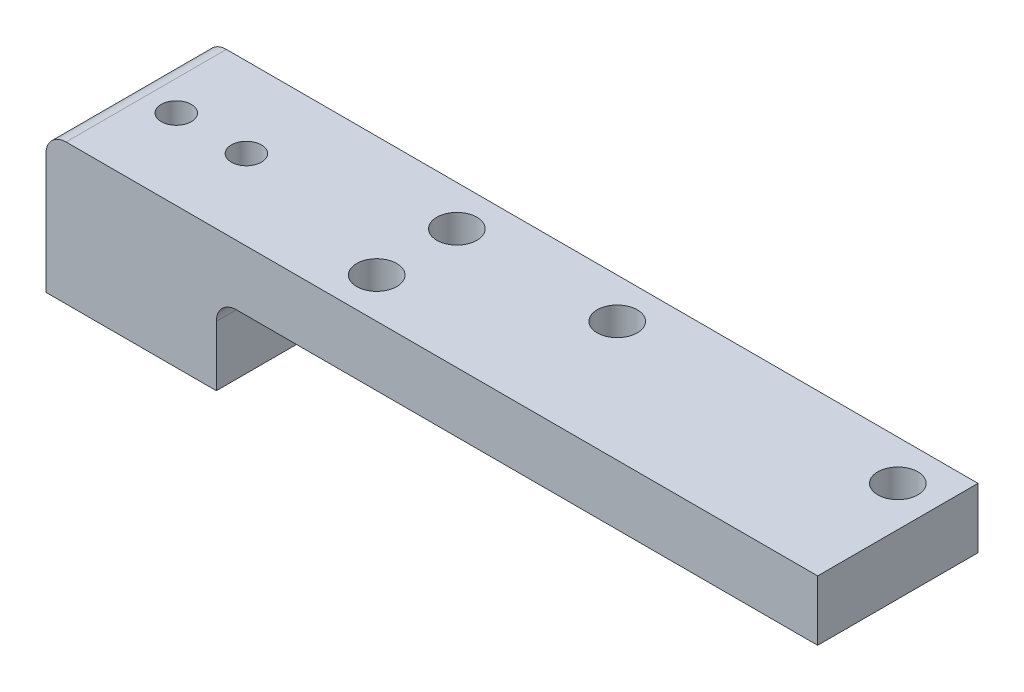
from build123d import *

# Parameters (mm, degrees)
SKETCH1_W           = 17
SKETCH1_H           = 16
SKETCH1_R           = 1.5
BOSS_EXTRUDE1_DEPTH = 14
SKETCH3_W           = 16
SKETCH3_H           = 6
BOSS_EXTRUDE2_DEPTH = 60
SKETCH4_R           = 2
CUT_EXTRUDE1_DEPTH  = 71.372224634
FILLET1_R           = 2
FILLET2_R           = 2


with BuildPart() as part:
    # Sketch1 → Boss-Extrude1 (new body)
    with BuildSketch(Plane(origin=(0, 0, 0), x_dir=(1, 0, 0), z_dir=(0, 1, 0))):
        Rectangle(SKETCH1_W, SKETCH1_H)
        with Locations(Location((-3.5, 0, 0), (0, 0, 270))):
            Circle(SKETCH1_R, mode=Mode.SUBTRACT)
        with Locations(Location((3.5, 0, 0), (0, 0, 270))):
            Circle(SKETCH1_R, mode=Mode.SUBTRACT)
    extrude(amount=BOSS_EXTRUDE1_DEPTH)

    # Sketch3 → Boss-Extrude2 (add)
    with BuildSketch(Plane(origin=(8.5, 0, 0), x_dir=(0, 0, -1), z_dir=(1, 0, 0))):
        with Locations((0, 11)):
            Rectangle(SKETCH3_W, SKETCH3_H)
    extrude(amount=BOSS_EXTRUDE2_DEPTH)

    # Sketch4 → Cut-Extrude1 (cut, through all)
    with BuildSketch(Plane(origin=(0, 14, 0), x_dir=(1, 0, 0), z_dir=(0, 1, 0))):
        with Locations(Location((36.5, 4, 0), (0, 0, 270))):
            Circle(SKETCH4_R)
        with Locations(Location((64.5, 4, 0), (0, 0, 270))):
            Circle(SKETCH4_R)
        with Locations(Location((20.5, 4, 0), (0, 0, 270))):
            Circle(SKETCH4_R)
        with Locations(Location((20.5, -4, 0), (0, 0, 270))):
            Circle(SKETCH4_R)
    extrude(amount=-CUT_EXTRUDE1_DEPTH, mode=Mode.SUBTRACT)

    # Fillet1
    fillet1_edges = [part.edges().sort_by_distance(p)[0] for p in [
        (8.5, 8, 0),
    ]]
    fillet(fillet1_edges, radius=FILLET1_R)

    # Fillet2
    fillet2_edges = [part.edges().sort_by_distance(p)[0] for p in [
        (-8.5, 14, 0),
    ]]
    fillet(fillet2_edges, radius=FILLET2_R)


solid = part.part
